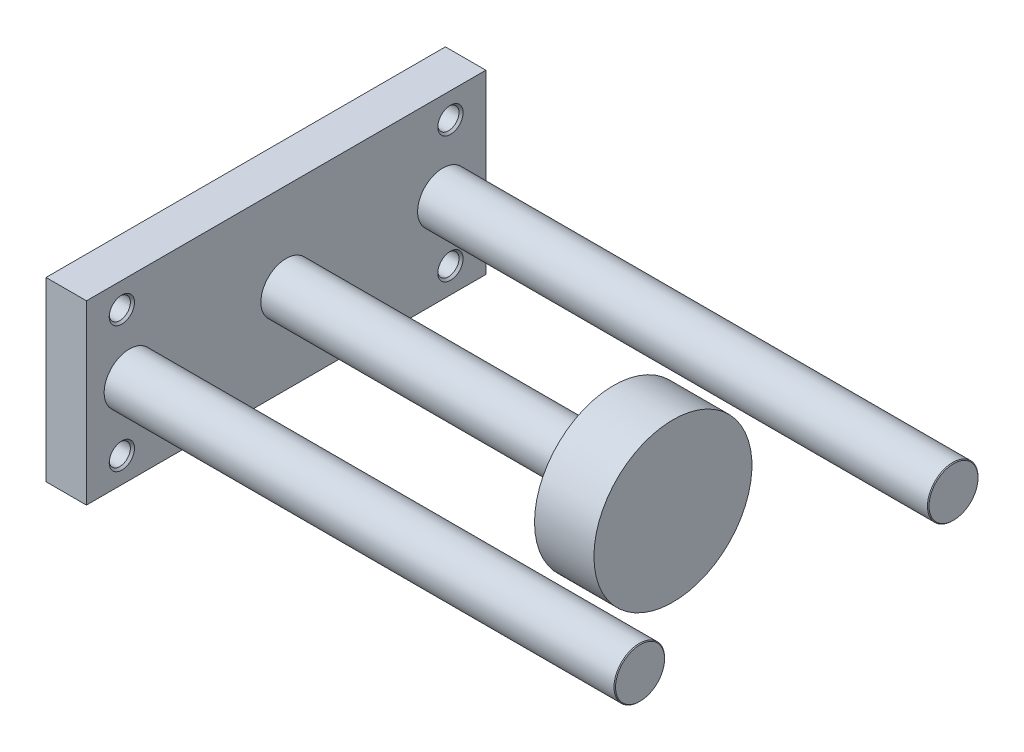
from build123d import *

# Parameters (mm, degrees)
SKETCH_1_W                  = 158
SKETCH_1_H                  = 70
EXTRUDE_1_DEPTH             = 16
PATTERN_LINEAR_1_COUNT      = 3
PATTERN_LINEAR_1_PITCH      = 62
PATTERN_LINEAR_2_COUNT      = 2
PATTERN_LINEAR_2_PITCH      = 130
PATTERN_LINEAR_2_COUNT_DIR2 = 2
PATTERN_LINEAR_2_PITCH_DIR2 = 50
SKETCH_9_W                  = 8
SKETCH_9_H                  = 2.5
HOLE_WIZARD_1_D             = 5
HOLE_WIZARD_1_DEPTH         = 8
HOLE_WIZARD_1_TIP           = 1.443375673
CUT_EXTRUDE_1_DEPTH         = 4


with BuildPart() as part:
    # 草图1 → 凸台-拉伸1 (new body)
    with BuildSketch(Plane(origin=(0, 0, 0), x_dir=(0, 0, -1), z_dir=(1, 0, 0))):
        Rectangle(SKETCH_1_W, SKETCH_1_H)
    extrude(amount=EXTRUDE_1_DEPTH)

    # 草图2 → 切除-旋转1 (revolve, cut)
    with BuildSketch(Plane.XY.offset(62)):
        with BuildLine():
            Line((0, 9.25), (0, 7.5))
            ThreePointArc((0, 7.5), (0.146446609, 7.853553391), (0.5, 8))
            Line((0.5, 8), (6.5, 8))
            Line((6.5, 8), (6.5, 9))
            Line((6.5, 9), (0.25, 9))
            Line((0.25, 9), (0, 9.25))
        make_face()
    cut_revolve_1 = revolve(axis=Axis((6.5, 0, 62), (-1, 0, 0)), mode=Mode.SUBTRACT)

    # 阵列(线性)1: 切除-旋转1 ×3
    with Locations(*[(0, 0, -i * PATTERN_LINEAR_1_PITCH) for i in range(1, PATTERN_LINEAR_1_COUNT)]):
        add(cut_revolve_1, mode=Mode.SUBTRACT)

    # 草图4 → 旋转1 (revolve)
    with BuildSketch(Plane.XY):
        Polygon((16, 0), (16, 10), (145.5, 10), (145.5, 31.25), (169, 31.25), (169, 0), align=None)
    revolve(axis=Axis((169, 0, 0), (-1, 0, 0)))

    # 草图5 → 旋转2 (revolve)
    with BuildSketch(Plane.XY.offset(62)):
        Polygon((16, 0), (16, 10), (217.7, 10), (218, 9.7), (218, 0), align=None)
    revolve(axis=Axis((218, 0, 62), (-1, 0, 0)))

    # 草图6 → 旋转3 (revolve)
    with BuildSketch(Plane.XY.offset(-62)):
        Polygon((16, 0), (16, 10), (217.7, 10), (218, 9.7), (218, 0), align=None)
    revolve(axis=Axis((218, 0, -62), (-1, 0, 0)))

    # 草图7 → 切除-旋转2 (revolve, cut)
    with BuildSketch(Plane.XY.offset(65)):
        Polygon((0, -25), (0, -20), (0.812, -20.812), (15.188, -20.812), (16, -20), (16, -25), align=None)
    cut_revolve_2 = revolve(axis=Axis((16, -25, 65), (-1, 0, 0)), mode=Mode.SUBTRACT)

    # 阵列(线性)2: Cut-Revolve 2 2 × 2
    with Locations(*[(0, j * PATTERN_LINEAR_2_PITCH_DIR2, -i * PATTERN_LINEAR_2_PITCH) for i in range(PATTERN_LINEAR_2_COUNT) for j in range(PATTERN_LINEAR_2_COUNT_DIR2) if (i, j) != (0, 0)]):
        add(cut_revolve_2, mode=Mode.SUBTRACT)

    # 草图9 → 切除-旋转3 (revolve, cut)
    with BuildSketch(Plane.XY.offset(40)):
        with Locations((4, 1.25)):
            Rectangle(SKETCH_9_W, SKETCH_9_H)
    revolve(axis=Axis((8, 0, 40), (-1, 0, 0)), mode=Mode.SUBTRACT)

    # 孔1
    with Locations(Plane.ZY):
        with Locations((-40, 0)):
            Hole(HOLE_WIZARD_1_D / 2, depth=HOLE_WIZARD_1_DEPTH)
            with Locations((0, 0, -(HOLE_WIZARD_1_DEPTH + HOLE_WIZARD_1_TIP / 2))):  # 120° drill point
                Cone(0, HOLE_WIZARD_1_D / 2, HOLE_WIZARD_1_TIP, mode=Mode.SUBTRACT)

    # 草图12 → 切除-拉伸1 (cut)
    with BuildSketch(Plane(origin=(0, 0, 0), x_dir=(0, 0, -1), z_dir=(1, 0, 0))):
        with BuildLine():
            Line((39.7, -2.5), (40.3, -2.5))
            ThreePointArc((40.3, -2.5), (42.8, 0), (40.3, 2.5))
            Line((40.3, 2.5), (39.7, 2.5))
            ThreePointArc((39.7, 2.5), (37.2, 0), (39.7, -2.5))
        make_face()
    extrude(amount=CUT_EXTRUDE_1_DEPTH, mode=Mode.SUBTRACT)


solid = part.part
